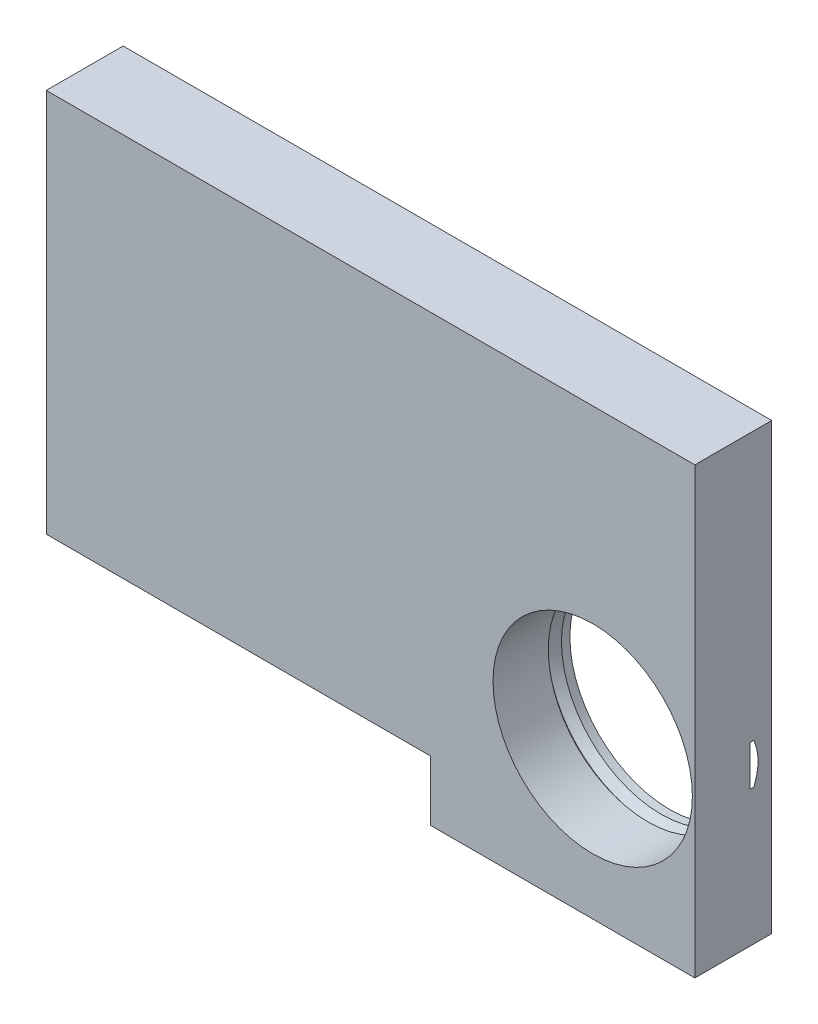
from build123d import *

# Parameters (mm, degrees)
SKETCH1_R           = 4.15
BOSS_EXTRUDE1_DEPTH = 3.2
SKETCH1_3_R         = 2.575
CUT_EXTRUDE1_DEPTH  = 1.8


with BuildPart() as part:
    # Sketch1 → Boss-Extrude1 (new body)
    with BuildSketch(Plane.XY.offset(17.54359624)):
        Polygon((8.498833186, -40.5), (-18.501166814, -40.5), (-18.501166814, -56.5), (-2.501166814, -56.5), (-2.501166814, -59), (8.498833186, -59), align=None)
        with Locations((4.246216621, -52.5)):
            Circle(SKETCH1_R, mode=Mode.SUBTRACT)
    extrude(amount=BOSS_EXTRUDE1_DEPTH)

    # Sketch2 → Cut-Revolve1 (revolve, cut)
    with BuildSketch(Plane(origin=(4.246216621, -52.5, 15.44359624), x_dir=(1, 0, 0), z_dir=(0, 1, 0))):
        Polygon((-3.899999957, -1.91392917), (-3.899999957, -3), (-4.335, -3), (-4.335, -2.846789772), align=None)
    revolve(axis=Axis((4.246216621, -52.5, 18.34359624), (0, 0, -1)), mode=Mode.SUBTRACT)

    # Sketch1<3> → Cut-Extrude1 (cut)
    with BuildSketch(Plane.XY.offset(17.54359624)):
        with Locations((-14.476166814, -44.525)):
            Circle(SKETCH1_3_R)
        with Locations((-6.526166814, -44.525)):
            Circle(SKETCH1_3_R)
        with Locations((-6.526166814, -52.475)):
            Circle(SKETCH1_3_R)
        with Locations((-14.476166814, -52.475)):
            Circle(SKETCH1_3_R)
    extrude(amount=CUT_EXTRUDE1_DEPTH, mode=Mode.SUBTRACT)


solid = part.part
